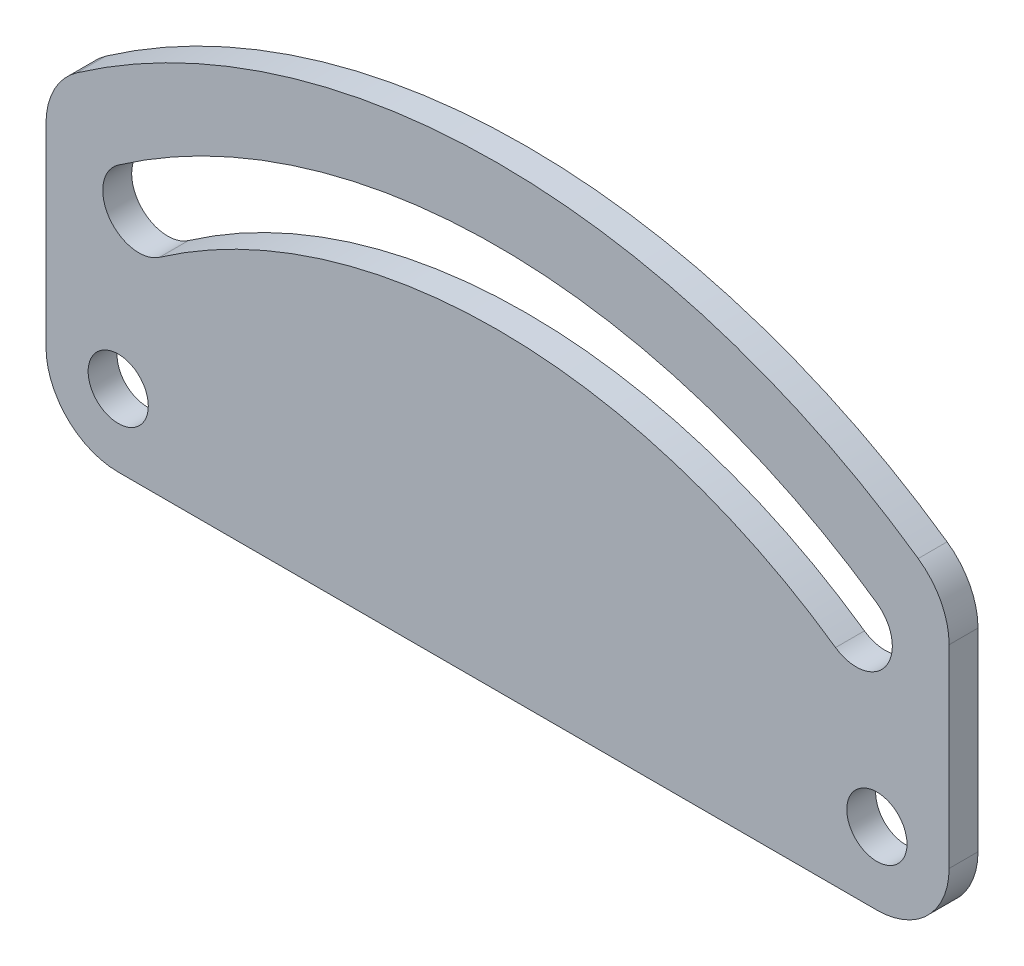
from build123d import *

# Parameters (mm, degrees)
SKETCH1_R           = 2.645472677
BOSS_EXTRUDE1_DEPTH = 2.54


with BuildPart() as part:
    # Sketch1 → Boss-Extrude1 (new body)
    # profile 1 of 2: a face of its own
    with BuildSketch(Plane.XY):
        with BuildLine():
            ThreePointArc((2.715551876, 28.591516871), (0.719669389, 26.320778151), (0, 23.384474828))
            Line((0, 23.384474828), (0, 6.35))
            ThreePointArc((0, 6.35), (1.859871939, 1.859871939), (6.35, 0))
            Line((6.35, 0), (39.703606091, 0))
            Line((39.703606091, 0), (39.703606091, 27.523486691))
            ThreePointArc((39.703606091, 27.523486691), (24.126563096, 25.131896001), (9.984448124, 18.177432785))
            ThreePointArc((9.984448124, 18.177432785), (5.563703041, 18.963729745), (6.35, 23.384474828))
            ThreePointArc((6.35, 23.384474828), (22.221598132, 31.189420948), (39.703606091, 33.873486691))
            Line((39.703606091, 33.873486691), (39.703606091, 40.223486691))
            ThreePointArc((39.703606091, 40.223486691), (20.316633168, 37.246945895), (2.715551876, 28.591516871))
        make_face()
        with Locations((6.35, 6.35)):
            Circle(SKETCH1_R, mode=Mode.SUBTRACT)
    # profile 2 of 2: a face of its own
    with BuildSketch(Plane.XY):
        with BuildLine():
            ThreePointArc((76.691660306, 28.591516871), (59.090579014, 37.246945895), (39.703606091, 40.223486691))
            Line((39.703606091, 40.223486691), (39.703606091, 33.873486691))
            ThreePointArc((39.703606091, 33.873486691), (57.18561405, 31.189420948), (73.057212182, 23.384474828))
            ThreePointArc((73.057212182, 23.384474828), (73.843509142, 18.963729745), (69.422764059, 18.177432785))
            ThreePointArc((69.422764059, 18.177432785), (55.280649086, 25.131896001), (39.703606091, 27.523486691))
            Line((39.703606091, 27.523486691), (39.703606091, 0))
            Line((39.703606091, 0), (73.057212182, 0))
            ThreePointArc((73.057212182, 0), (77.547340243, 1.859871939), (79.407212182, 6.35))
            Line((79.407212182, 6.35), (79.407212182, 23.384474828))
            ThreePointArc((79.407212182, 23.384474828), (78.687542794, 26.320778151), (76.691660306, 28.591516871))
        make_face()
        with Locations((73.057212182, 6.35)):
            Circle(SKETCH1_R, mode=Mode.SUBTRACT)
    extrude(amount=-BOSS_EXTRUDE1_DEPTH)


solid = part.part
